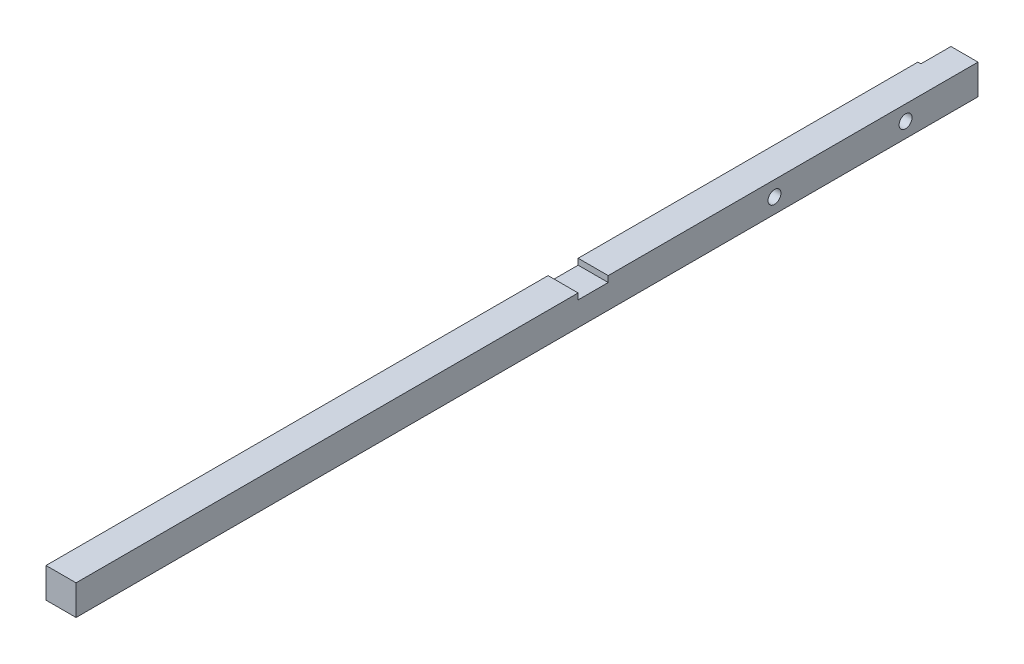
from build123d import *

# Parameters (mm, degrees)
BOSS_EXTRU_1_START      = 7
ESQUISSE1_W             = 10
ESQUISSE1_H             = 10
BOSS_EXTRU_1_DEPTH      = 300
ESQUISSE4_W             = 10
ESQUISSE4_H             = 2
ENL_V_MAT_EXTRU_3_DEPTH = 308.203515605
ESQUISSE6_W             = 10
ESQUISSE6_H             = 10
ENL_V_MAT_EXTRU_5_DEPTH = 1
D_GAGEMENT_M41_D        = 4.3


with BuildPart() as part:
    # Esquisse1 → Boss.-Extru.1 (new body)
    with BuildSketch(Plane.XY.offset(BOSS_EXTRU_1_START)):
        Rectangle(ESQUISSE1_W, ESQUISSE1_H)
    extrude(amount=BOSS_EXTRU_1_DEPTH)

    # Esquisse4 → Enlèv. mat.-Extru.3 (cut, through all)
    with BuildSketch(Plane(origin=(5, 0, 0), x_dir=(0, 0, -1), z_dir=(1, 0, 0))):
        with Locations((-135, 4)):
            Rectangle(ESQUISSE4_W, ESQUISSE4_H)
    extrude(amount=-ENL_V_MAT_EXTRU_3_DEPTH, mode=Mode.SUBTRACT)

    # Esquisse6 → Enlèv. mat.-Extru.5 (cut)
    with BuildSketch(Plane.ZY.offset(5)):
        with Locations((12, 0)):
            Rectangle(ESQUISSE6_W, ESQUISSE6_H)
    extrude(amount=-ENL_V_MAT_EXTRU_5_DEPTH, mode=Mode.SUBTRACT)

    # Dégagement M41 (through all)
    with Locations(Plane.ZY.offset(5)):
        with Locations((74.69, 0), (31.09, 0)):
            Hole(D_GAGEMENT_M41_D / 2)


solid = part.part
